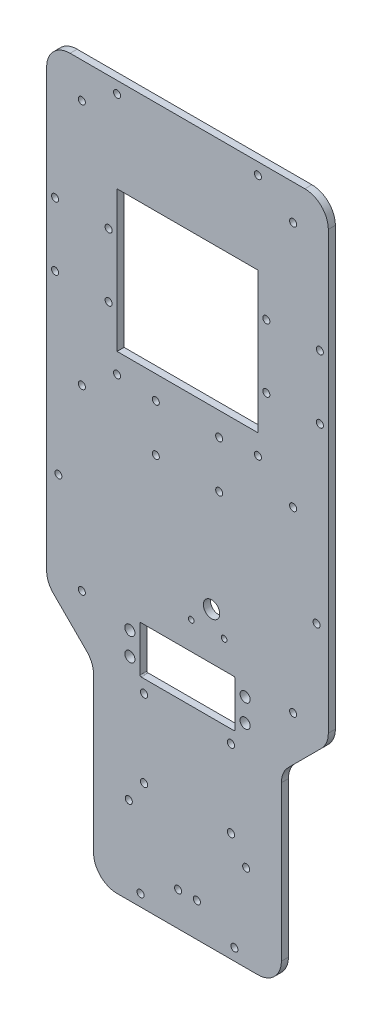
from build123d import *

# Parameters (mm, degrees)
CROQUIS8_R              = 1.5
CROQUIS8_W              = 60
CROQUIS8_H              = 60
SALIENTE_EXTRUIR1_DEPTH = 3
CROQUIS14_R             = 1.5
CORTAR_EXTRUIR5_DEPTH   = 162.582796114
CROQUIS15_R             = 1.5
CORTAR_EXTRUIR6_DEPTH   = 162.582796114
CORTAR_EXTRUIR7_DEPTH   = 23
CROQUIS17_R             = 1.5
CROQUIS17_R_2           = 1.55
CORTAR_EXTRUIR8_DEPTH   = 10
CROQUIS18_R             = 1.2
CORTAR_EXTRUIR9_DEPTH   = 10
CROQUIS19_R             = 1.5
CORTAR_EXTRUIR10_DEPTH  = 10
CROQUIS20_R             = 1.5
CORTAR_EXTRUIR11_DEPTH  = 10
CORTAR_EXTRUIR12_DEPTH  = 10


with BuildPart() as part:
    # Croquis8 → Saliente-Extruir1 (new body)
    with BuildSketch(Plane.XY):
        with BuildLine():
            Line((-30, -150), (30, -150))
            ThreePointArc((30, -150), (37.071067812, -147.071067812), (40, -140))
            Line((40, -140), (40, -74.142135624))
            ThreePointArc((40, -74.142135624), (40.761204675, -70.3153013), (42.928932188, -67.071067812))
            Line((42.928932188, -67.071067812), (57.071067812, -52.928932188))
            ThreePointArc((57.071067812, -52.928932188), (59.238795325, -49.6846987), (60, -45.857864376))
            Line((60, -45.857864376), (60, 140))
            ThreePointArc((60, 140), (57.071067812, 147.071067812), (50, 150))
            Line((50, 150), (-50, 150))
            ThreePointArc((-50, 150), (-57.071067812, 147.071067812), (-60, 140))
            Line((-60, 140), (-60, -45.857864376))
            ThreePointArc((-60, -45.857864376), (-59.238795325, -49.6846987), (-57.071067812, -52.928932188))
            Line((-57.071067812, -52.928932188), (-42.928932188, -67.071067812))
            ThreePointArc((-42.928932188, -67.071067812), (-40.761204675, -70.3153013), (-40, -74.142135624))
            Line((-40, -74.142135624), (-40, -140))
            ThreePointArc((-40, -140), (-37.071067812, -147.071067812), (-30, -150))
        make_face()
        with Locations((33.6, 66.5)):
            Circle(CROQUIS8_R, mode=Mode.SUBTRACT)
        with Locations((56.4, 66.5)):
            Circle(CROQUIS8_R, mode=Mode.SUBTRACT)
        with Locations((56.4, 93.5)):
            Circle(CROQUIS8_R, mode=Mode.SUBTRACT)
        with Locations((33.6, 93.5)):
            Circle(CROQUIS8_R, mode=Mode.SUBTRACT)
        with Locations((13.5, 40)):
            Circle(CROQUIS8_R, mode=Mode.SUBTRACT)
        with Locations((13.5, 20)):
            Circle(CROQUIS8_R, mode=Mode.SUBTRACT)
        with Locations((-13.5, 20)):
            Circle(CROQUIS8_R, mode=Mode.SUBTRACT)
        with Locations((-13.5, 40)):
            Circle(CROQUIS8_R, mode=Mode.SUBTRACT)
        with Locations((-56.4, 66.5)):
            Circle(CROQUIS8_R, mode=Mode.SUBTRACT)
        with Locations((-33.6, 66.5)):
            Circle(CROQUIS8_R, mode=Mode.SUBTRACT)
        with Locations((-33.6, 93.5)):
            Circle(CROQUIS8_R, mode=Mode.SUBTRACT)
        with Locations((-56.4, 93.5)):
            Circle(CROQUIS8_R, mode=Mode.SUBTRACT)
        with Locations((0, 80)):
            Rectangle(CROQUIS8_W, CROQUIS8_H, mode=Mode.SUBTRACT)
    extrude(amount=SALIENTE_EXTRUIR1_DEPTH)

    # Croquis14 → Cortar-Extruir5 (cut, through all)
    with BuildSketch(Plane(origin=(0, 0, 0), x_dir=(-1, 0, 0), z_dir=(0, 0, -1))):
        with Locations(Location((45, 135, 0), (0, 0, 180))):
            Circle(CROQUIS14_R)
        with Locations((-45, 135)):
            Circle(CROQUIS14_R)
        with Locations((-45, -45.857864376)):
            Circle(CROQUIS14_R)
        with Locations(Location((45, -45.857864376, 0), (0, 0, 180))):
            Circle(CROQUIS14_R)
        with Locations((45, 30)):
            Circle(CROQUIS14_R)
        with Locations(Location((-45, 30, 0), (0, 0, 180))):
            Circle(CROQUIS14_R)
    extrude(amount=-CORTAR_EXTRUIR5_DEPTH, mode=Mode.SUBTRACT)

    # Croquis15 → Cortar-Extruir6 (cut, through all)
    with BuildSketch(Plane(origin=(0, 0, 0), x_dir=(-1, 0, 0), z_dir=(0, 0, -1))):
        with Locations((30, 145)):
            Circle(CROQUIS15_R)
        with Locations(Location((-30, 145, 0), (0, 0, 180))):
            Circle(CROQUIS15_R)
        with Locations((20, -145)):
            Circle(CROQUIS15_R)
        with Locations(Location((-20, -145, 0), (0, 0, 180))):
            Circle(CROQUIS15_R)
        with Locations((55, -7.928932188)):
            Circle(CROQUIS15_R)
        with Locations(Location((-55, -7.928932188, 0), (0, 0, 180))):
            Circle(CROQUIS15_R)
    extrude(amount=-CORTAR_EXTRUIR6_DEPTH, mode=Mode.SUBTRACT)

    # Croquis16 → Cortar-Extruir7 (cut)
    with BuildSketch(Plane.XY.offset(3)):
        with BuildLine():
            Line((20.25, -64.5), (20.25, -55.5))
            Line((20.25, -55.5), (20.25, -54.5))
            Line((20.25, -54.5), (20.25, -45.5))
            ThreePointArc((20.25, -45.5), (20.103553391, -45.146446609), (19.75, -45))
            Line((19.75, -45), (-19.75, -45))
            ThreePointArc((-19.75, -45), (-20.103553391, -45.146446609), (-20.25, -45.5))
            Line((-20.25, -45.5), (-20.25, -54.5))
            Line((-20.25, -54.5), (-20.25, -55.5))
            Line((-20.25, -55.5), (-20.25, -64.5))
            ThreePointArc((-20.25, -64.5), (-20.103553391, -64.853553391), (-19.75, -65))
            Line((-19.75, -65), (19.75, -65))
            ThreePointArc((19.75, -65), (20.103553391, -64.853553391), (20.25, -64.5))
        make_face()
    extrude(amount=-CORTAR_EXTRUIR7_DEPTH, mode=Mode.SUBTRACT)

    # Croquis17 → Cortar-Extruir8 (cut)
    with BuildSketch(Plane(origin=(0, 0, 0), x_dir=(-1, 0, 0), z_dir=(0, 0, -1))):
        with Locations((-25, -113)):
            Circle(CROQUIS17_R)
        with Locations((25, -113)):
            Circle(CROQUIS17_R)
        with Locations((-18.5, -70.5)):
            Circle(CROQUIS17_R_2)
        with Locations((18.5, -70.5)):
            Circle(CROQUIS17_R_2)
        with Locations((-18.5, -103.5)):
            Circle(CROQUIS17_R_2)
        with Locations((18.5, -103.5)):
            Circle(CROQUIS17_R_2)
        with BuildLine():
            ThreePointArc((-6.75, -25), (-10.25, -21.5), (-13.75, -25))
            ThreePointArc((-13.75, -25), (-10.25, -28.5), (-6.75, -25))
        make_face()
    extrude(amount=-CORTAR_EXTRUIR8_DEPTH, mode=Mode.SUBTRACT)

    # Croquis18 → Cortar-Extruir9 (cut)
    with BuildSketch(Plane.XY.offset(3)):
        with Locations((1.6, -33.2)):
            Circle(CROQUIS18_R)
        with Locations((15.6, -33.2)):
            Circle(CROQUIS18_R)
    extrude(amount=-CORTAR_EXTRUIR9_DEPTH, mode=Mode.SUBTRACT)

    # Croquis19 → Cortar-Extruir10 (cut)
    with BuildSketch(Plane.XY.offset(3)):
        with Locations((-4, -135.549922457)):
            Circle(CROQUIS19_R)
        with Locations((4.000000635, -135.549923318)):
            Circle(CROQUIS19_R)
    extrude(amount=-CORTAR_EXTRUIR10_DEPTH, mode=Mode.SUBTRACT)

    # Croquis20 → Cortar-Extruir11 (cut)
    with BuildSketch(Plane.XY.offset(3)):
        with Locations((-30, 41.5)):
            Circle(CROQUIS20_R)
        with Locations((30, 41.5)):
            Circle(CROQUIS20_R)
    extrude(amount=-CORTAR_EXTRUIR11_DEPTH, mode=Mode.SUBTRACT)

    # Croquis22 → Cortar-Extruir12 (cut)
    with BuildSketch(Plane.XY.offset(3)):
        with BuildLine():
            ThreePointArc((26.312169292, -48.918229167), (22.4, -50.15), (26.312169292, -51.381770833))
            ThreePointArc((26.312169292, -51.381770833), (26.7, -50.15), (26.312169292, -48.918229167))
        make_face()
        with BuildLine():
            ThreePointArc((26.312169292, -58.618229167), (22.4, -59.85), (26.312169292, -61.081770833))
            ThreePointArc((26.312169292, -61.081770833), (26.7, -59.85), (26.312169292, -58.618229167))
        make_face()
        with BuildLine():
            ThreePointArc((-26.312169292, -61.081770833), (-22.4, -59.85), (-26.312169292, -58.618229167))
            ThreePointArc((-26.312169292, -58.618229167), (-26.7, -59.85), (-26.312169292, -61.081770833))
        make_face()
        with BuildLine():
            ThreePointArc((-26.312169292, -51.381770833), (-22.4, -50.15), (-26.312169292, -48.918229167))
            ThreePointArc((-26.312169292, -48.918229167), (-26.7, -50.15), (-26.312169292, -51.381770833))
        make_face()
    extrude(amount=-CORTAR_EXTRUIR12_DEPTH, mode=Mode.SUBTRACT)


solid = part.part
